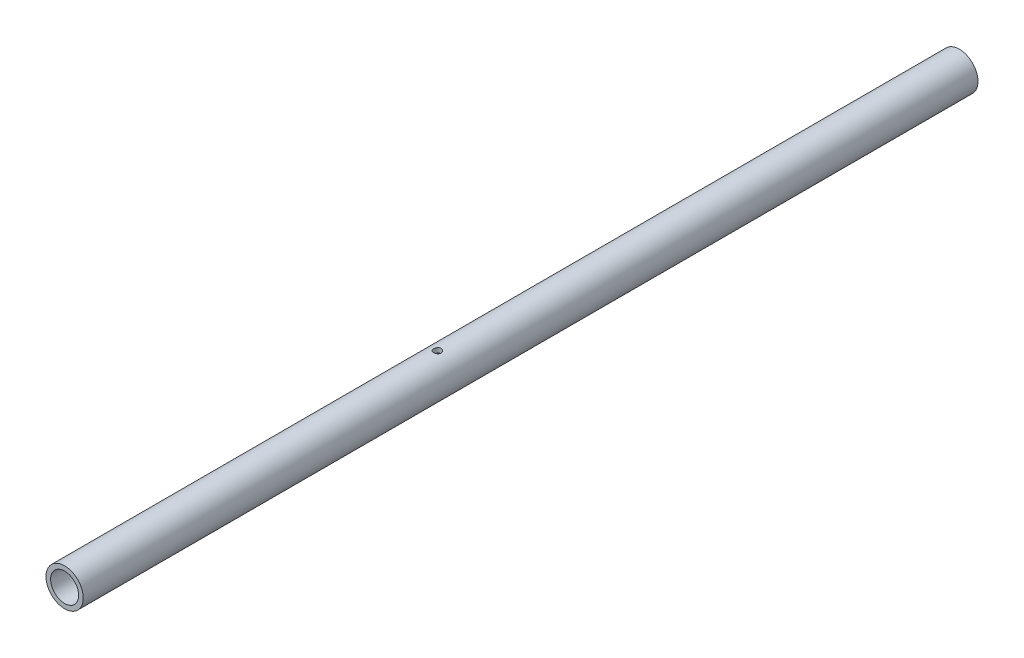
from build123d import *

# Parameters (mm, degrees)
SKETCH1_R           = 12.7
SKETCH1_R_2         = 9.55675
BOSS_EXTRUDE1_DEPTH = 609.6
SKETCH4_W           = 2.5527
SKETCH4_H           = 15.109663775


with BuildPart() as part:
    # Sketch1 → Boss-Extrude1 (new body)
    with BuildSketch(Plane.XY):
        with Locations(Location((-13.862261993, 2.409663775, 0), (0, 0, 180))):
            Circle(SKETCH1_R)
        with Locations(Location((-13.862261993, 2.409663775, 0), (0, 0, 180))):
            Circle(SKETCH1_R_2, mode=Mode.SUBTRACT)
    extrude(amount=BOSS_EXTRUDE1_DEPTH)

    # Sketch4 → Alignment Pin Bolt Hole (Clearance for 10-32) (revolve, cut)
    with BuildSketch(Plane(origin=(-13.862261993, 0, 355.6), x_dir=(0, 0, -1), z_dir=(1, 0, 0))):
        with Locations((1.27635, 7.554831888)):
            Rectangle(SKETCH4_W, SKETCH4_H)
    revolve(axis=Axis((-13.862261993, -6.35, 355.6), (0, 1, 0)), mode=Mode.SUBTRACT)


solid = part.part
